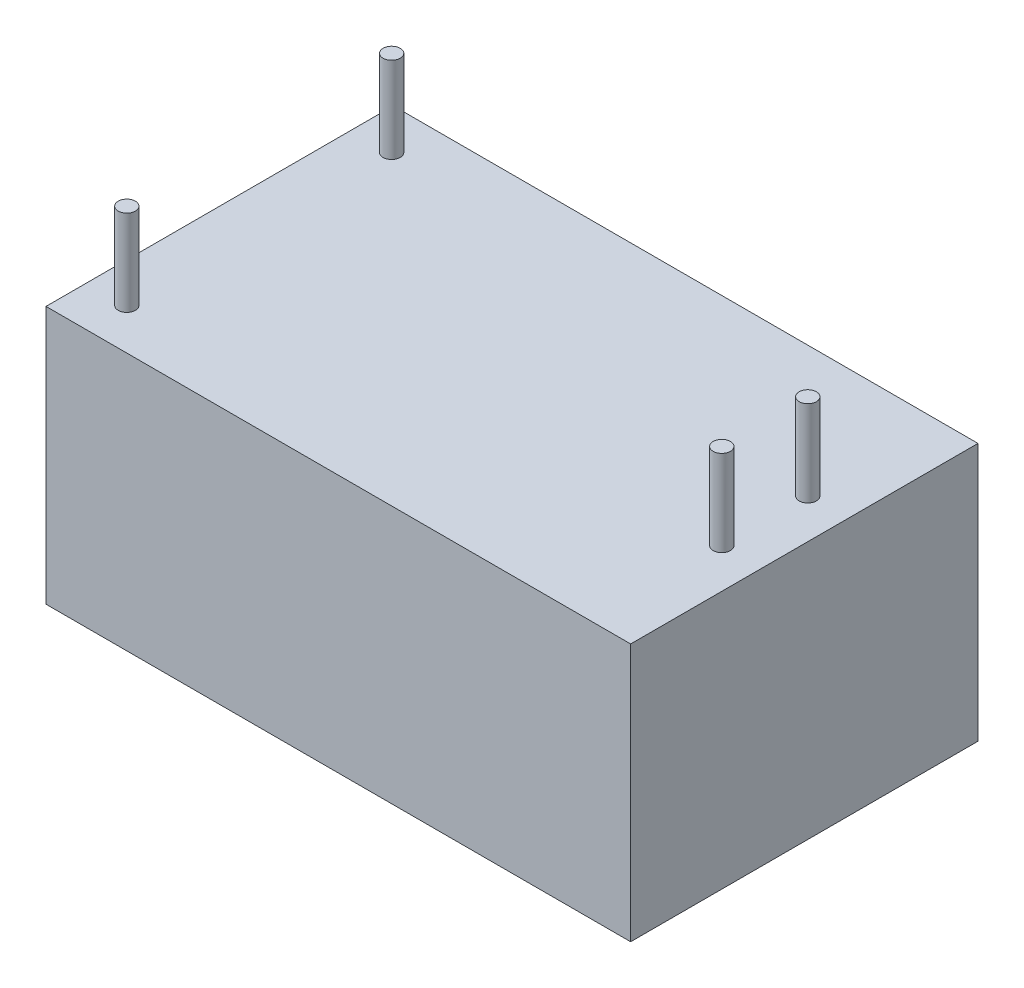
from build123d import *

# Parameters (mm, degrees)
CROQUIS1_W              = 34
CROQUIS1_H              = 20.2
SALIENTE_EXTRUIR1_DEPTH = 15
CROQUIS2_R              = 0.5
SALIENTE_EXTRUIR2_DEPTH = 5


with BuildPart() as part:
    # Croquis1 → Saliente-Extruir1 (new body)
    with BuildSketch(Plane(origin=(0, 0, 0), x_dir=(1, 0, 0), z_dir=(0, 1, 0))):
        Rectangle(CROQUIS1_W, CROQUIS1_H)
    extrude(amount=SALIENTE_EXTRUIR1_DEPTH)

    # Croquis2 → Saliente-Extruir2 (add)
    with BuildSketch(Plane(origin=(0, 15, 0), x_dir=(1, 0, 0), z_dir=(0, 1, 0))):
        with Locations(Location((-14.7, 7.7, 0), (0, 0, 90))):
            Circle(CROQUIS2_R)
        with Locations(Location((-14.7, -7.7, 0), (0, 0, 90))):
            Circle(CROQUIS2_R)
        with Locations(Location((14.7, -2.5, 0), (0, 0, 90))):
            Circle(CROQUIS2_R)
        with Locations(Location((14.7, 2.5, 0), (0, 0, 90))):
            Circle(CROQUIS2_R)
    extrude(amount=SALIENTE_EXTRUIR2_DEPTH)


solid = part.part
